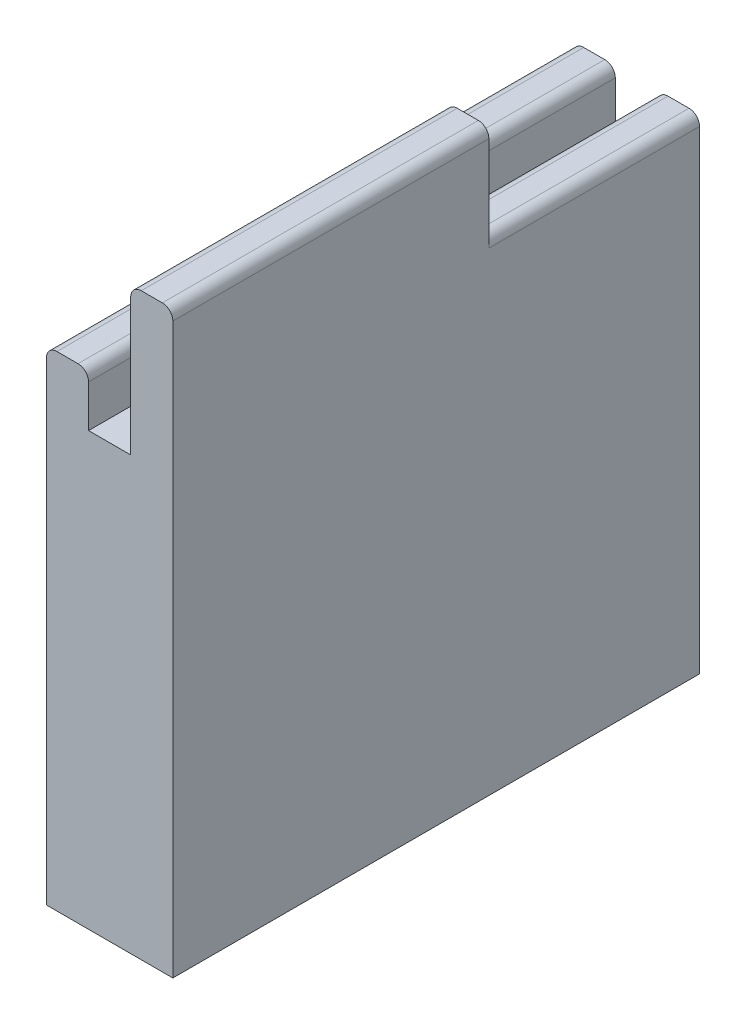
from build123d import *

# Parameters (mm, degrees)
BOSS_EXTRU_1_DEPTH = 25
CONG_1_R           = 0.5
ESQUISSE2_W        = 15
ESQUISSE2_H        = 5
BOSS_EXTRU_2_DEPTH = 2
CONG_2_R           = 0.5


with BuildPart() as part:
    # Esquisse1 → Boss.-Extru.1 (new body)
    with BuildSketch(Plane.XY):
        Polygon((-4.120689655, 2.5), (-2.120689655, 2.5), (-2.120689655, 0), (-0.120689655, 0), (-0.120689655, 2.5), (1.879310345, 2.5), (1.879310345, -20.5), (-4.120689655, -20.5), align=None)
    extrude(amount=BOSS_EXTRU_1_DEPTH)

    # Congé1
    cong_1_edges = [part.edges().sort_by_distance(p)[0] for p in [
        (-4.120689655, 2.5, 12.5),
        (-2.120689655, 2.5, 12.5),
        (-0.120689655, 2.5, 12.5),
        (1.879310345, 2.5, 12.5),
    ]]
    fillet(cong_1_edges, radius=CONG_1_R)

    # Esquisse2 → Boss.-Extru.2 (add)
    with BuildSketch(Plane(origin=(1.879310345, 0, 0), x_dir=(0, 0, -1), z_dir=(1, 0, 0))):
        with Locations((-17.5, 4.5)):
            Rectangle(ESQUISSE2_W, ESQUISSE2_H)
    extrude(amount=-BOSS_EXTRU_2_DEPTH)

    # Congé2
    cong_2_edges = [part.edges().sort_by_distance(p)[0] for p in [
        (-0.120689655, 7, 17.5),
        (1.879310345, 7, 17.5),
    ]]
    fillet(cong_2_edges, radius=CONG_2_R)


solid = part.part
